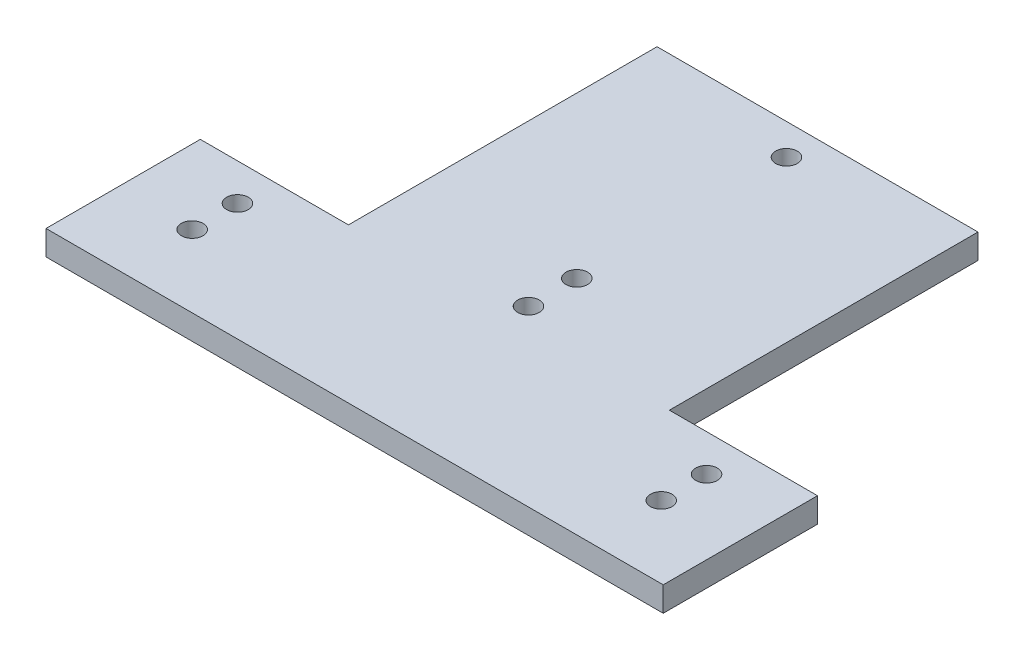
from build123d import *

# Parameters (mm, degrees)
CROQUIS1_R              = 1.75
SALIENTE_EXTRUIR1_DEPTH = 4


with BuildPart() as part:
    # Croquis1 → Saliente-Extruir1 (new body)
    with BuildSketch(Plane(origin=(0, 0, 0), x_dir=(1, 0, 0), z_dir=(0, 1, 0))):
        Polygon((-26, -12.5), (-50, -12.5), (-50, -37.5), (50, -37.5), (50, -12.5), (26, -12.5), (26, 37.5), (-26, 37.5), align=None)
        with Locations(Location((-38, -25.816065761, 0), (0, 0, 270))):
            Circle(CROQUIS1_R, mode=Mode.SUBTRACT)
        with Locations(Location((-38, -18.479827089, 0), (0, 0, 270))):
            Circle(CROQUIS1_R, mode=Mode.SUBTRACT)
        with Locations(Location((0, -9.329285485, 0), (0, 0, 270))):
            Circle(CROQUIS1_R, mode=Mode.SUBTRACT)
        with Locations(Location((0, -1.504051409, 0), (0, 0, 270))):
            Circle(CROQUIS1_R, mode=Mode.SUBTRACT)
        with Locations(Location((38, -25.816065761, 0), (0, 0, 270))):
            Circle(CROQUIS1_R, mode=Mode.SUBTRACT)
        with Locations(Location((38, -18.479827089, 0), (0, 0, 270))):
            Circle(CROQUIS1_R, mode=Mode.SUBTRACT)
        with Locations(Location((0, 32.46376687, 0), (0, 0, 270))):
            Circle(CROQUIS1_R, mode=Mode.SUBTRACT)
    extrude(amount=SALIENTE_EXTRUIR1_DEPTH)


solid = part.part
